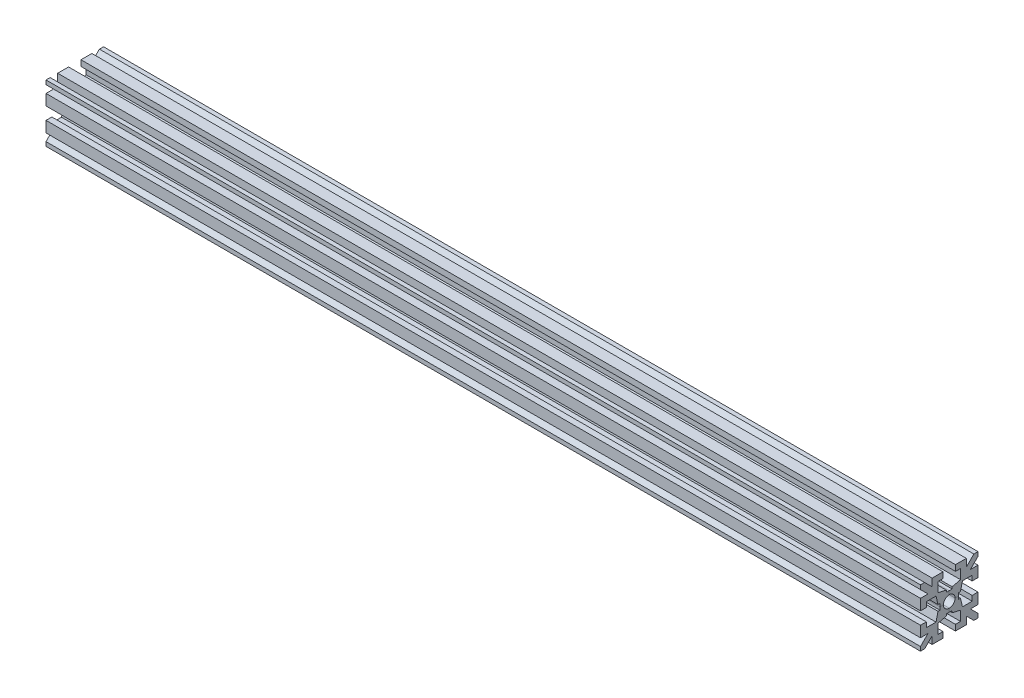
from build123d import *

# Parameters (mm, degrees)
BOSS_EXTRUDE1_DEPTH = 225
CIRPATTERN1_COUNT   = 4


with BuildPart() as part:
    # Sketch1 → Boss-Extrude1 (new body)
    with BuildSketch(Plane(origin=(0, 0, 0), x_dir=(0, 0, -1), z_dir=(1, 0, 0))):
        with BuildLine():
            Line((-2.4, 0), (-2.4, 0.75))
            Line((-2.4, 0.75), (-2.9, 0.75))
            Line((-2.9, 0.75), (-3.4, 2.9))
            Line((-3.4, 2.9), (-5.9, 2.9))
            Line((-5.9, 2.9), (-5.9, 1.6))
            Line((-5.9, 1.6), (-7.4, 1.6))
            Line((-7.4, 1.6), (-7.4, 4.4))
            Line((-7.4, 4.4), (-5.460660172, 4.4))
            Line((-5.460660172, 4.4), (-7.4, 6.339339828))
            Line((-7.4, 6.339339828), (-7.4, 7.4))
            Line((-7.4, 7.4), (-6.339339828, 7.4))
            Line((-6.339339828, 7.4), (-4.4, 5.460660172))
            Line((-4.4, 5.460660172), (-4.4, 7.4))
            Line((-4.4, 7.4), (-1.6, 7.4))
            Line((-1.6, 7.4), (-1.6, 5.9))
            Line((-1.6, 5.9), (-2.9, 5.9))
            Line((-2.9, 5.9), (-2.9, 3.4))
            Line((-2.9, 3.4), (-0.75, 2.9))
            Line((-0.75, 2.9), (-0.75, 2.4))
            Line((-0.75, 2.4), (0, 2.4))
            Line((0, 2.4), (0, 1.5))
            ThreePointArc((0, 1.5), (-1.060660172, 1.060660172), (-1.5, 0))
            Line((-1.5, 0), (-2.4, 0))
        make_face()
    extrude(amount=-BOSS_EXTRUDE1_DEPTH)


with BuildPart() as cirpattern1_1:
    # CirPattern1: pattern copy
    add(part.part.rotate(Axis((-262.5, 0, 0), (1, 0, 0)), 1 * 360 / CIRPATTERN1_COUNT))


with BuildPart() as cirpattern1_2:
    # CirPattern1: pattern copy
    add(part.part.rotate(Axis((-262.5, 0, 0), (1, 0, 0)), 2 * 360 / CIRPATTERN1_COUNT))


with BuildPart() as cirpattern1_3:
    # CirPattern1: pattern copy
    add(part.part.rotate(Axis((-262.5, 0, 0), (1, 0, 0)), 3 * 360 / CIRPATTERN1_COUNT))


solid = Compound([part.part, cirpattern1_1.part, cirpattern1_2.part, cirpattern1_3.part])
